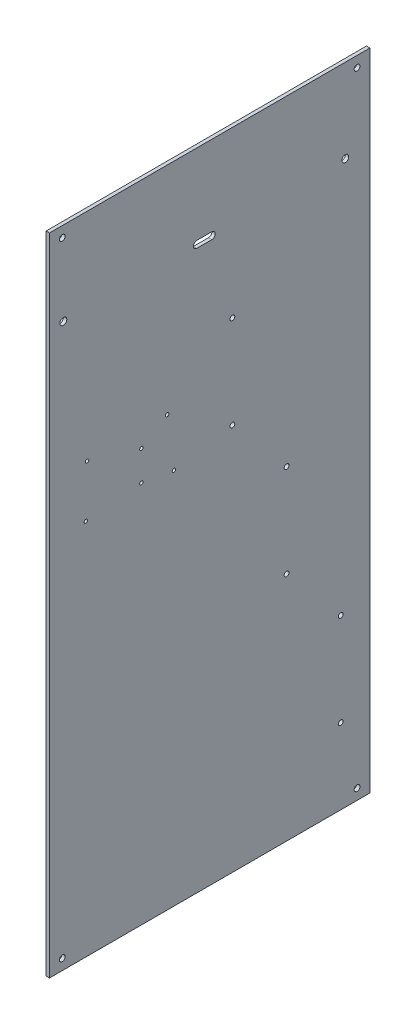
from build123d import *

# Parameters (mm, degrees)
BOSS_EXTRUDE1_DEPTH      = 1.5875
BOSS_EXTRUDE1_DEPTH_BACK = 1.5875
SKETCH1_W                = 300
SKETCH1_H                = 604.2
CUT_EXTRUDE1_DEPTH       = 338.29353708
CUT_EXTRUDE1_DEPTH_BACK  = 338.29353708
SKETCH2_R                = 2.7
CUT_EXTRUDE2_DEPTH       = 338.29353708
CUT_EXTRUDE2_DEPTH_BACK  = 338.29353708
SKETCH3_R                = 1.6
SKETCH3_R_2              = 2.25
SKETCH3_R_3              = 3.2


with BuildPart() as part:
    # Sketch1 → Boss-Extrude1 (new, two sides: drawn at the far end of the back side and taken through both)
    with BuildSketch(Plane(origin=(0, 0, 0), x_dir=(0, 0, -1), z_dir=(1, 0, 0)).offset(-BOSS_EXTRUDE1_DEPTH_BACK)):
        Rectangle(SKETCH1_W, SKETCH1_H)
    extrude(amount=BOSS_EXTRUDE1_DEPTH + BOSS_EXTRUDE1_DEPTH_BACK)

    # Sketch2 → Cut-Extrude1 (cut, two sides: drawn at the far end of the back side and taken through both)
    with BuildSketch(Plane(origin=(0, 0, 0), x_dir=(0, 0, -1), z_dir=(1, 0, 0)).offset(-CUT_EXTRUDE1_DEPTH_BACK)):
        with Locations((-138, 292.1)):
            Circle(SKETCH2_R)
        with Locations((138, 292.1)):
            Circle(SKETCH2_R)
        with Locations((138, -292.1)):
            Circle(SKETCH2_R)
        with Locations((-138, -292.1)):
            Circle(SKETCH2_R)
    extrude(amount=CUT_EXTRUDE1_DEPTH + CUT_EXTRUDE1_DEPTH_BACK, mode=Mode.SUBTRACT)

    # Sketch3 → Cut-Extrude2 (cut, two sides: drawn at the far end of the back side and taken through both)
    with BuildSketch(Plane(origin=(0, 0, 0), x_dir=(0, 0, -1), z_dir=(1, 0, 0)).offset(-CUT_EXTRUDE2_DEPTH_BACK)):
        with Locations((-116.03, 51.300005788)):
            Circle(SKETCH3_R)
        with Locations((-114.76, 99.560005788)):
            Circle(SKETCH3_R)
        with Locations((-63.96, 56.380005788)):
            Circle(SKETCH3_R)
        with Locations((-63.96, 84.320005788)):
            Circle(SKETCH3_R)
        with Locations((-33.48, 51.300005788)):
            Circle(SKETCH3_R)
        with Locations((-39.83, 99.560005788)):
            Circle(SKETCH3_R)
        with Locations((21.25, 60.6)):
            Circle(SKETCH3_R_2)
        with Locations((21.25, 147.6)):
            Circle(SKETCH3_R_2)
        with Locations((72, 1.6)):
            Circle(SKETCH3_R_2)
        with Locations((72, -85.4)):
            Circle(SKETCH3_R_2)
        with Locations((122.75, -144.4)):
            Circle(SKETCH3_R_2)
        with Locations((122.75, -231.4)):
            Circle(SKETCH3_R_2)
        with Locations((-137, 223.8634)):
            Circle(SKETCH3_R_3)
        with Locations((127, 223.8634)):
            Circle(SKETCH3_R_3)
        with BuildLine():
            Line((-12, 227.0634), (2, 227.0634))
            ThreePointArc((2, 227.0634), (5.2, 223.8634), (2, 220.6634))
            Line((2, 220.6634), (-12, 220.6634))
            ThreePointArc((-12, 220.6634), (-15.2, 223.8634), (-12, 227.0634))
        make_face()
    extrude(amount=CUT_EXTRUDE2_DEPTH + CUT_EXTRUDE2_DEPTH_BACK, mode=Mode.SUBTRACT)


solid = part.part
